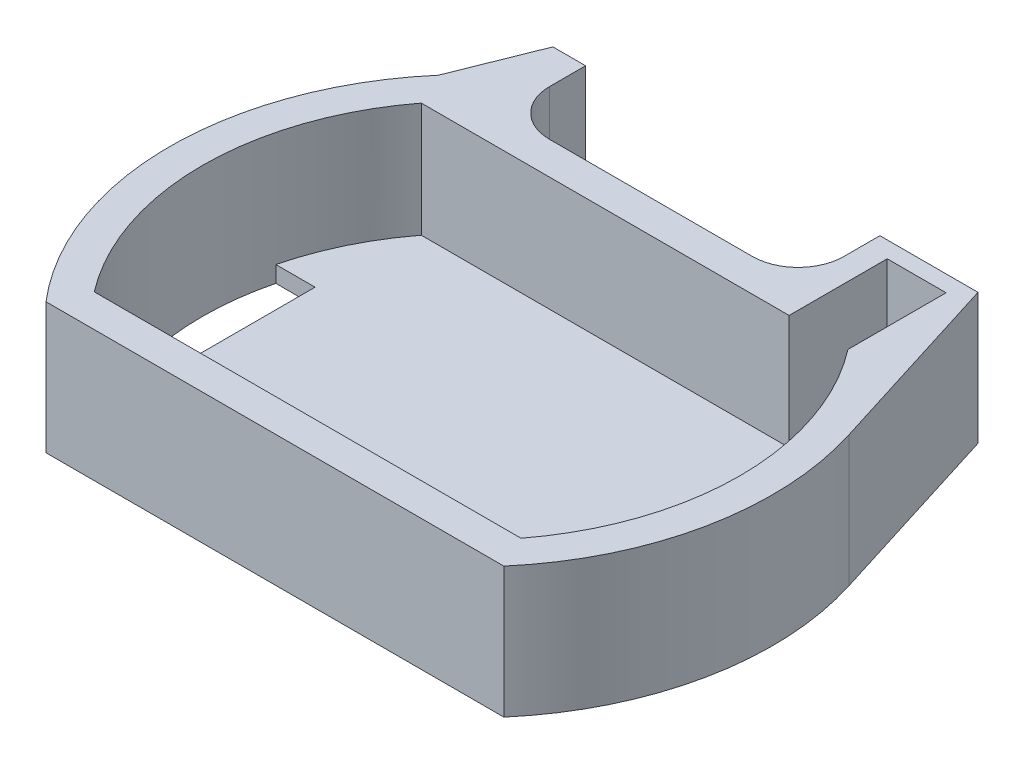
from build123d import *

# Parameters (mm, degrees)
BOSS_EXTRUDE1_DEPTH = 6.35
BOSS_EXTRUDE2_DEPTH = 44.45
SKETCH4_W           = 12.7
SKETCH4_H           = 31.75
BOSS_EXTRUDE4_DEPTH = 50.8
SKETCH5_W           = 22.86
SKETCH5_H           = 38.1
CUT_EXTRUDE1_DEPTH  = 44.45
FILLET3_R           = 17.78


with BuildPart() as part:
    # Sketch1 → Boss-Extrude1 (new body)
    with BuildSketch(Plane(origin=(0, 0, 0), x_dir=(1, 0, 0), z_dir=(0, 1, 0))):
        with BuildLine():
            Line((-88.9, -76.2), (88.9, -76.2))
            ThreePointArc((88.9, -76.2), (114.692568029, -23.564058203), (111.741834586, 34.977312694))
            Line((111.741834586, 34.977312694), (88.9, 107.95))
            Line((88.9, 107.95), (63.5, 107.95))
            Line((63.5, 107.95), (63.5, 76.2))
            Line((63.5, 76.2), (-63.5, 76.2))
            Line((-63.5, 76.2), (-63.5, 107.95))
            Line((-63.5, 107.95), (-76.2, 107.95))
            Line((-76.2, 107.95), (-88.9, 76.2))
            ThreePointArc((-88.9, 76.2), (-117.088214608, 0), (-88.9, -76.2))
        make_face()
        with BuildLine():
            Line((-101.250873324, 25.4), (-86.010873324, 25.4))
            Line((-86.010873324, 25.4), (-86.010873324, -25.4))
            Line((-86.010873324, -25.4), (-101.250873324, -25.4))
            ThreePointArc((-101.250873324, -25.4), (-104.388214608, 0), (-101.250873324, 25.4))
        make_face(mode=Mode.SUBTRACT)
        with BuildLine():
            Line((86.010873324, -25.4), (101.250873324, -25.4))
            ThreePointArc((101.250873324, -25.4), (104.388214608, 0), (101.250873324, 25.4))
            Line((101.250873324, 25.4), (86.010873324, 25.4))
            Line((86.010873324, 25.4), (86.010873324, -25.4))
        make_face(mode=Mode.SUBTRACT)
    extrude(amount=BOSS_EXTRUDE1_DEPTH)

    # Sketch2 → Boss-Extrude2 (add)
    with BuildSketch(Plane(origin=(0, 6.35, 0), x_dir=(1, 0, 0), z_dir=(0, 1, 0))):
        with BuildLine():
            Line((-88.9, -76.2), (88.9, -76.2))
            ThreePointArc((88.9, -76.2), (114.692568029, -23.564058203), (111.741834586, 34.977312694))
            Line((111.741834586, 34.977312694), (88.9, 107.95))
            Line((88.9, 107.95), (63.5, 107.95))
            Line((63.5, 107.95), (63.5, 76.2))
            Line((63.5, 76.2), (-63.5, 76.2))
            Line((-63.5, 76.2), (-63.5, 107.95))
            Line((-63.5, 107.95), (-76.2, 107.95))
            Line((-76.2, 107.95), (-88.9, 76.2))
            ThreePointArc((-88.9, 76.2), (-117.088214608, 0), (-88.9, -76.2))
        make_face()
        with BuildLine():
            Line((-82.853179474, -63.5), (82.853179474, -63.5))
            ThreePointArc((82.853179474, -63.5), (104.388214608, 0), (82.853179474, 63.5))
            Line((82.853179474, 63.5), (-82.853179474, 63.5))
            ThreePointArc((-82.853179474, 63.5), (-104.388214608, 0), (-82.853179474, -63.5))
        make_face(mode=Mode.SUBTRACT)
    extrude(amount=BOSS_EXTRUDE2_DEPTH)

    # Sketch4 → Boss-Extrude4 (add)
    with BuildSketch(Plane(origin=(0, 50.8, 0), x_dir=(1, 0, 0), z_dir=(0, 1, 0))):
        with Locations((57.15, 92.075)):
            Rectangle(SKETCH4_W, SKETCH4_H)
    extrude(amount=-BOSS_EXTRUDE4_DEPTH)

    # Sketch5 → Cut-Extrude1 (cut)
    with BuildSketch(Plane(origin=(0, 50.8, 0), x_dir=(1, 0, 0), z_dir=(0, 1, 0))):
        with Locations((71.423179474, 82.55)):
            Rectangle(SKETCH5_W, SKETCH5_H)
    extrude(amount=-CUT_EXTRUDE1_DEPTH, mode=Mode.SUBTRACT)

    # Fillet3
    fillet3_edges = [part.edges().sort_by_distance(p)[0] for p in [
        (50.8, 25.4, -76.2),
        (-63.5, 25.4, -76.2),
    ]]
    fillet(fillet3_edges, radius=FILLET3_R)


solid = part.part
